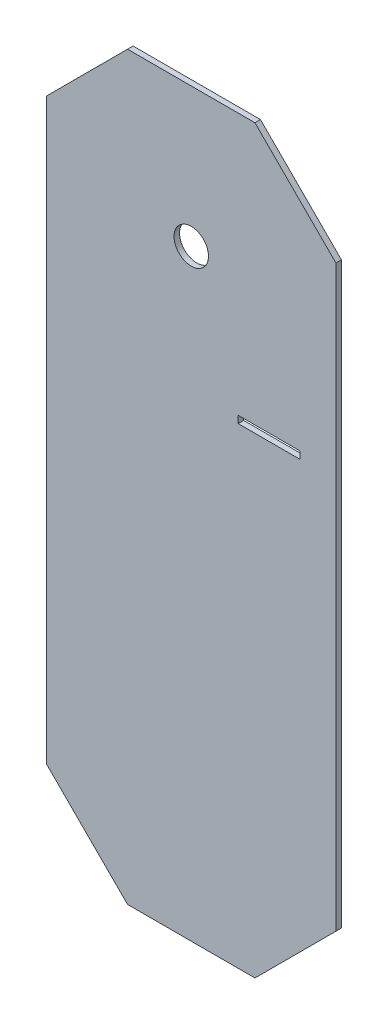
from build123d import *

# Parameters (mm, degrees)
SKETCH_1_R          = 12.5
EXTRUDE_1_DEPTH     = 4
SKETCH_2_W          = 45
SKETCH_2_H          = 5.25
CUT_EXTRUDE_1_DEPTH = 650.332288577


with BuildPart() as part:
    # Эскиз1 → Вытянуть1 (new body)
    with BuildSketch(Plane.XY):
        Polygon((-105, 539.996445798), (-105, 203.99388251), (-105, 161.99388251), (-46.222366275, 103.216248785), (46.222366275, 103.216248785), (105, 161.99388251), (105, 203.99388251), (105, 539.996445798), (105, 581.996445798), (46.222366275, 640.774079523), (-46.222366275, 640.774079523), (-105, 581.996445798), align=None)
        with Locations((0, 539.996445798)):
            Circle(SKETCH_1_R, mode=Mode.SUBTRACT)
    extrude(amount=EXTRUDE_1_DEPTH)

    # Эскиз2 → Вырез-Вытянуть1 (cut, through all)
    with BuildSketch(Plane.XY.offset(4)):
        with Locations((56.53130754, 448.199029203)):
            Rectangle(SKETCH_2_W, SKETCH_2_H)
    extrude(amount=-CUT_EXTRUDE_1_DEPTH, mode=Mode.SUBTRACT)


solid = part.part
